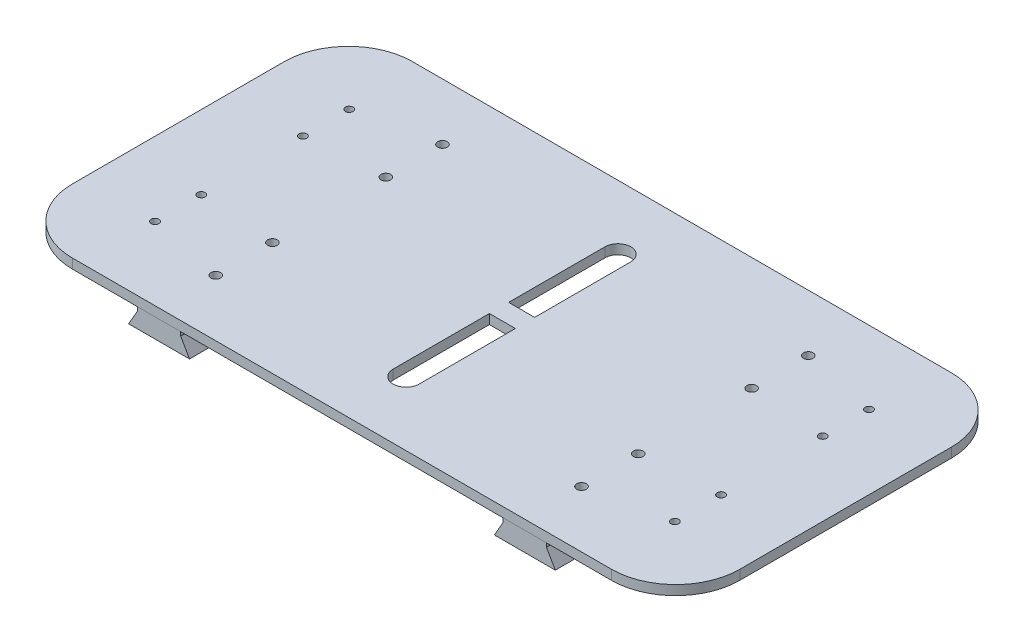
from build123d import *

# Parameters (mm, degrees)
BOSS_EXTRUDE1_DEPTH = 106
FILLET1_R           = 20
SKETCH3_R           = 1.5
CUT_EXTRUDE3_DEPTH  = 10
SKETCH6_R           = 1.2
CUT_EXTRUDE4_DEPTH  = 10


with BuildPart() as part:
    # Sketch1 → Boss-Extrude1 (new body)
    with BuildSketch(Plane.XY):
        Polygon((208, 3), (0, 3), (0, 0), (40.271281292, 0), (53.728718708, 0), (154.271281292, 0), (167.728718708, 0), (208, 0), align=None)
        Polygon((167.728718708, -1.2), (167.728718708, 0), (154.271281292, 0), (154.271281292, -1.2), (151.5, -6), (170.5, -6), align=None)
        Polygon((53.728718708, 0), (40.271281292, 0), (40.271281292, -1.2), (37.5, -6), (56.5, -6), (53.728718708, -1.2), align=None)
    extrude(amount=BOSS_EXTRUDE1_DEPTH)

    # Fillet1
    fillet1_edges = [part.edges().sort_by_distance(p)[0] for p in [
        (208, 1.5, 106),
        (0, 1.5, 0),
        (208, 1.5, 0),
        (0, 1.5, 106),
    ]]
    fillet(fillet1_edges, radius=FILLET1_R)

    # Sketch3 → Cut-Extrude3 (cut)
    with BuildSketch(Plane(origin=(0, 3, 0), x_dir=(1, 0, 0), z_dir=(0, 1, 0))):
        with BuildLine():
            Line((108.05, -50), (108.05, -20))
            ThreePointArc((108.05, -20), (104, -15.95), (99.95, -20))
            Line((99.95, -20), (99.95, -50))
            Line((99.95, -50), (108.05, -50))
        make_face()
        with BuildLine():
            Line((108.05, -86), (108.05, -56))
            Line((108.05, -56), (99.95, -56))
            Line((99.95, -56), (99.95, -86))
            ThreePointArc((99.95, -86), (104, -90.05), (108.05, -86))
        make_face()
        with Locations(Location((47, -70.666666667, 0), (0, 0, 180))):
            Circle(SKETCH3_R)
        with Locations(Location((47, -88.333333333, 0), (0, 0, 180))):
            Circle(SKETCH3_R)
        with Locations((161, -88.333333333)):
            Circle(SKETCH3_R)
        with Locations((161, -70.666666667)):
            Circle(SKETCH3_R)
        with Locations(Location((161, -17.666666667, 0), (0, 0, 180))):
            Circle(SKETCH3_R)
        with Locations(Location((161, -35.333333333, 0), (0, 0, 180))):
            Circle(SKETCH3_R)
        with Locations(Location((47, -17.666666667, 0), (0, 0, 270))):
            Circle(SKETCH3_R)
        with Locations(Location((47, -35.333333333, 0), (0, 0, 270))):
            Circle(SKETCH3_R)
    extrude(amount=-CUT_EXTRUDE3_DEPTH, mode=Mode.SUBTRACT)

    # Sketch6 → Cut-Extrude4 (cut)
    with BuildSketch(Plane(origin=(0, 3, 0), x_dir=(1, 0, 0), z_dir=(0, 1, 0))):
        with Locations(Location((185, -22.74, 0), (0, 0, 180))):
            Circle(SKETCH6_R)
        with Locations(Location((185, -37.16, 0), (0, 0, 180))):
            Circle(SKETCH6_R)
        with Locations(Location((23, -22.74, 0), (0, 0, 270))):
            Circle(SKETCH6_R)
        with Locations(Location((23, -37.16, 0), (0, 0, 270))):
            Circle(SKETCH6_R)
        with Locations(Location((23, -83.26, 0), (0, 0, 180))):
            Circle(SKETCH6_R)
        with Locations(Location((23, -68.84, 0), (0, 0, 180))):
            Circle(SKETCH6_R)
        with Locations(Location((185, -83.26, 0), (0, 0, 270))):
            Circle(SKETCH6_R)
        with Locations(Location((185, -68.84, 0), (0, 0, 270))):
            Circle(SKETCH6_R)
    extrude(amount=-CUT_EXTRUDE4_DEPTH, mode=Mode.SUBTRACT)


with BuildPart() as body_2:
    # Split1: the piece on the far side of the plane
    add(part.part)
    split(bisect_by=Plane(origin=(0, 0, 0), x_dir=(0, 0, -1), z_dir=(0, -1, 0)), keep=Keep.BOTTOM)


with BuildPart() as part_1:
    add(part.part)

    # Split1
    split(bisect_by=Plane(origin=(0, 0, 0), x_dir=(0, 0, -1), z_dir=(0, -1, 0)), keep=Keep.TOP)


solid = Compound([body_2.part, part_1.part])
